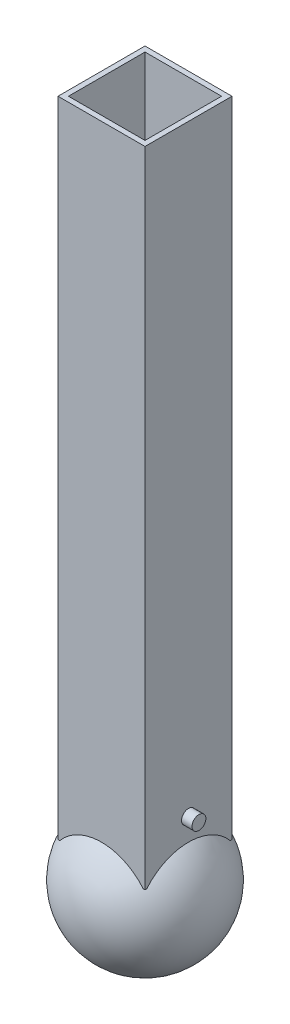
from build123d import *

# Parameters (mm, degrees)
SKETCH1_W           = 25
SKETCH1_H           = 25
BOSS_EXTRUDE1_DEPTH = 185
SKETCH3_W           = 22
SKETCH3_H           = 22
CUT_EXTRUDE1_DEPTH  = 300
SKETCH6_R           = 2
CUT_EXTRUDE3_DEPTH  = 25
SKETCH9_R           = 1.99
BOSS_EXTRUDE8_DEPTH = 28
SKETCH10_R          = 1.99
BOSS_EXTRUDE9_DEPTH = 3


with BuildPart() as part:
    # Sketch1 → Boss-Extrude1 (new body)
    with BuildSketch(Plane(origin=(0, 0, 0), x_dir=(1, 0, 0), z_dir=(0, 1, 0))):
        Rectangle(SKETCH1_W, SKETCH1_H)
    extrude(amount=BOSS_EXTRUDE1_DEPTH)

    # Sketch3 → Cut-Extrude1 (cut)
    with BuildSketch(Plane.XZ):
        Rectangle(SKETCH3_W, SKETCH3_H)
    extrude(amount=-CUT_EXTRUDE1_DEPTH, mode=Mode.SUBTRACT)

    # Sketch4 → Revolve1 (revolve)
    with BuildSketch(Plane(origin=(0, -10, 0), x_dir=(-1, 0, 0), z_dir=(0, -1, 0))):
        with BuildLine():
            Line((0, 20), (0, -20))
            ThreePointArc((0, -20), (-20, 0), (0, 20))
        make_face()
    revolve(axis=Axis((0, -10, -13.212098256), (0, 0, 1)))

    # Sketch6 → Cut-Extrude3 (cut)
    with BuildSketch(Plane(origin=(12.5, 0, 0), x_dir=(0, 0, -1), z_dir=(1, 0, 0))):
        with Locations((0, 12)):
            Circle(SKETCH6_R)
    extrude(amount=-CUT_EXTRUDE3_DEPTH, mode=Mode.SUBTRACT)


with BuildPart() as body_2:
    # Sketch9 → Boss-Extrude8 (new body)
    with BuildSketch(Plane.ZY.offset(12.5)):
        with Locations((0, 12)):
            Circle(SKETCH9_R)
    extrude(amount=-BOSS_EXTRUDE8_DEPTH)

    # Sketch10 → Boss-Extrude9 (add)
    with BuildSketch(Plane.ZY.offset(12.5)):
        with Locations((0, 12)):
            Circle(SKETCH10_R)
    extrude(amount=BOSS_EXTRUDE9_DEPTH)


solid = Compound([part.part, body_2.part])
